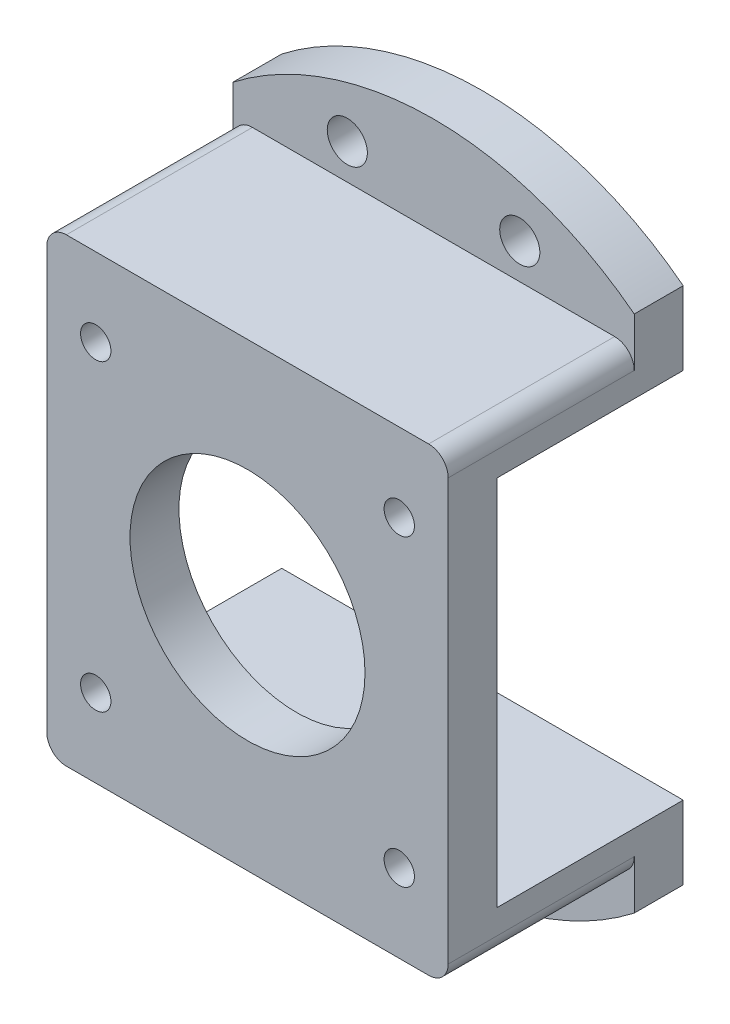
from build123d import *

# Parameters (mm, degrees)
SKETCH1_W           = 41
SKETCH1_H           = 38
SKETCH1_R           = 1.55
SKETCH1_R_2         = 12
BOSS_EXTRUDE1_DEPTH = 5
SKETCH2_W           = 41
SKETCH2_H           = 4.5
BOSS_EXTRUDE2_DEPTH = 24
SKETCH3_R           = 2.05
BOSS_EXTRUDE3_DEPTH = 5
FILLET1_R           = 2


with BuildPart() as part:
    # Sketch1 → Boss-Extrude1 (new body)
    with BuildSketch(Plane.XY):
        Rectangle(SKETCH1_W, SKETCH1_H)
        with Locations((15.5, 15.5)):
            Circle(SKETCH1_R, mode=Mode.SUBTRACT)
        with Locations((-15.5, 15.5)):
            Circle(SKETCH1_R, mode=Mode.SUBTRACT)
        with Locations((15.5, -15.5)):
            Circle(SKETCH1_R, mode=Mode.SUBTRACT)
        with Locations((-15.5, -15.5)):
            Circle(SKETCH1_R, mode=Mode.SUBTRACT)
        Circle(SKETCH1_R_2, mode=Mode.SUBTRACT)
    extrude(amount=BOSS_EXTRUDE1_DEPTH)

    # Sketch2 → Boss-Extrude2 (add)
    with BuildSketch(Plane.XY.offset(5)):
        with Locations((0, 21.25)):
            Rectangle(SKETCH2_W, SKETCH2_H)
        with Locations((0, -21.25)):
            Rectangle(SKETCH2_W, SKETCH2_H)
    extrude(amount=-BOSS_EXTRUDE2_DEPTH)

    # Sketch3 → Boss-Extrude3 (add)
    # profile 1 of 2: a face of its own
    with BuildSketch(Plane(origin=(0, 0, -19), x_dir=(-1, 0, 0), z_dir=(0, 0, -1))):
        with BuildLine():
            Line((-20.5, 26.495282599), (-20.5, 23.5))
            Line((-20.5, 23.5), (20.5, 23.5))
            Line((20.5, 23.5), (20.5, 26.495282599))
            ThreePointArc((20.5, 26.495282599), (10.831851903, 31.700488708), (-7.9e-08, 33.5))
            ThreePointArc((-7.9e-08, 33.5), (-10.831851978, 31.700488683), (-20.5, 26.495282599))
        make_face()
        with Locations((-8.80698434, 27.105110714)):
            Circle(SKETCH3_R, mode=Mode.SUBTRACT)
        with Locations((8.80698434, 27.105110714)):
            Circle(SKETCH3_R, mode=Mode.SUBTRACT)
    # profile 2 of 2: a face of its own
    with BuildSketch(Plane(origin=(0, 0, -19), x_dir=(-1, 0, 0), z_dir=(0, 0, -1))):
        with BuildLine():
            Line((-20.5, -23.5), (-20.5, -26.495282599))
            ThreePointArc((-20.5, -26.495282599), (-10.831851978, -31.700488683), (-7.9e-08, -33.5))
            ThreePointArc((-7.9e-08, -33.5), (10.831851903, -31.700488708), (20.5, -26.495282599))
            Line((20.5, -26.495282599), (20.5, -23.5))
            Line((20.5, -23.5), (-20.5, -23.5))
        make_face()
        with Locations((-8.80698434, -27.105110714)):
            Circle(SKETCH3_R, mode=Mode.SUBTRACT)
        with Locations((8.80698434, -27.105110714)):
            Circle(SKETCH3_R, mode=Mode.SUBTRACT)
    extrude(amount=-BOSS_EXTRUDE3_DEPTH)

    # Fillet1
    fillet1_edges = [part.edges().sort_by_distance(p)[0] for p in [
        (20.5, 23.5, -4.5),
        (-20.5, 23.5, -4.5),
        (-20.5, -23.5, -4.5),
        (20.5, -23.5, -4.5),
    ]]
    fillet(fillet1_edges, radius=FILLET1_R)


solid = part.part
